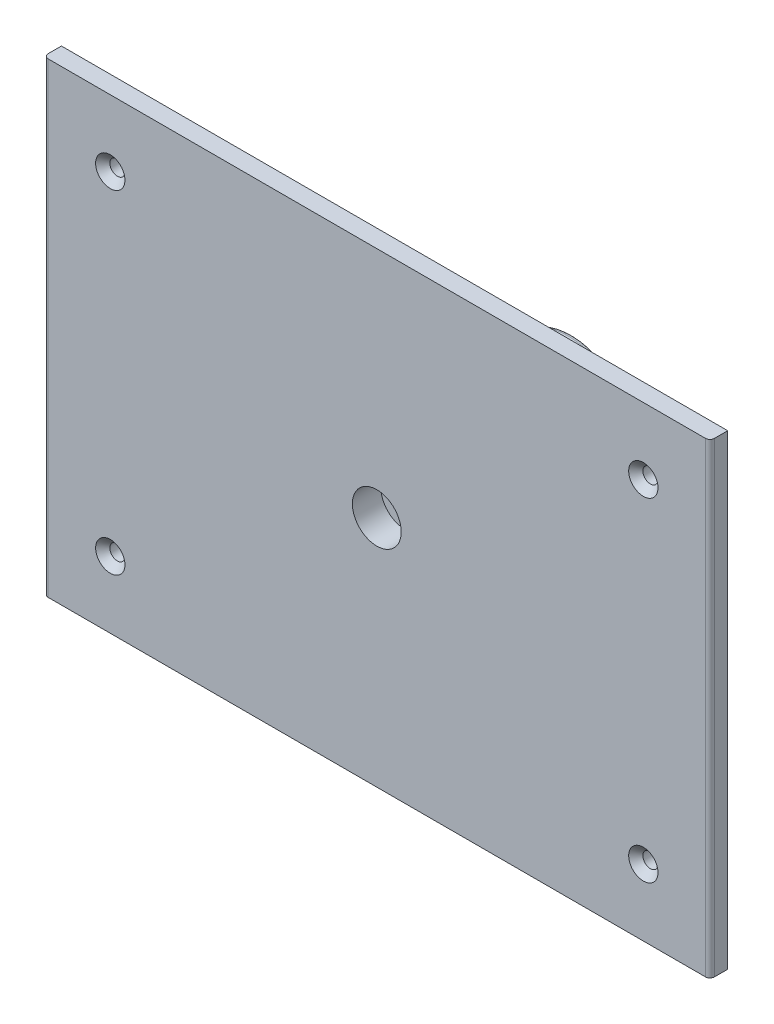
from build123d import *

# Parameters (mm, degrees)
SKETCH1_W                                           = 150
SKETCH1_H                                           = 105
BOSS_EXTRUDE1_DEPTH                                 = 2
M3_CLEARANCE_HOLE1_AT_2_COUNT                       = 2
M3_CLEARANCE_HOLE1_AT_2_PITCH                       = 120
SKETCH5_R                                           = 14
BOSS_EXTRUDE2_DEPTH                                 = 40
CBORE_FOR_M6_HEX_SOCKET_HEAD_CAP_SCREW1_D           = 6.6
CBORE_FOR_M6_HEX_SOCKET_HEAD_CAP_SCREW1_CBORE_D     = 11
CBORE_FOR_M6_HEX_SOCKET_HEAD_CAP_SCREW1_CBORE_DEPTH = 6.4
FILLET1_R                                           = 1
FILLET2_R                                           = 1
FILLET3_R                                           = 1


with BuildPart() as part:
    # Sketch1 → Boss-Extrude1 (new, symmetric)
    with BuildSketch(Plane.XY):
        Rectangle(SKETCH1_W, SKETCH1_H)
    extrude(amount=BOSS_EXTRUDE1_DEPTH, both=True)

    # Sketch4 → M3 Clearance Hole1 (revolve, cut)
    with BuildSketch(Plane(origin=(60, -37.5, -2), x_dir=(0, 1, 0), z_dir=(1, 0, 0))):
        Polygon((0, 0), (0, 4), (3.3, 4), (1.7, 2.4), (1.7, 0), align=None)
    m3_clearance_hole1 = revolve(axis=Axis((60, -37.5, -8.35), (0, 0, 1)), mode=Mode.SUBTRACT)

    # M3 Clearance Hole1 at 2: M3 Clearance Hole1 ×2
    with Locations(*[(-i * M3_CLEARANCE_HOLE1_AT_2_PITCH, 0, 0) for i in range(1, M3_CLEARANCE_HOLE1_AT_2_COUNT)]):
        add(m3_clearance_hole1, mode=Mode.SUBTRACT)

    # Sketch5 → Boss-Extrude2 (add)
    with BuildSketch(Plane(origin=(0, 0, -2), x_dir=(-1, 0, 0), z_dir=(0, 0, -1))):
        Circle(SKETCH5_R)
    extrude(amount=BOSS_EXTRUDE2_DEPTH)

    # CBORE for M6 Hex Socket Head Cap Screw1 (through all)
    with Locations(Plane.XY.offset(2)):
        with Locations((0, 0)):
            CounterBoreHole(CBORE_FOR_M6_HEX_SOCKET_HEAD_CAP_SCREW1_D / 2, CBORE_FOR_M6_HEX_SOCKET_HEAD_CAP_SCREW1_CBORE_D / 2, CBORE_FOR_M6_HEX_SOCKET_HEAD_CAP_SCREW1_CBORE_DEPTH)

    # Mirror1: M3 Clearance Hole1 across plane
    add(m3_clearance_hole1.mirror(Plane.ZX), mode=Mode.SUBTRACT)

    # Mirror1 copy 1 sketch → Mirror1 copy 1 (revolve, cut)
    with BuildSketch(Plane(origin=(-60, 37.5, -2), x_dir=(0, -1, 0), z_dir=(1, 0, 0))):
        Polygon((0, 0), (0, -4), (3.3, -4), (1.7, -2.4), (1.7, 0), align=None)
    revolve(axis=Axis((-60, 37.5, -8.35), (0, 0, -1)), mode=Mode.SUBTRACT)

    # Fillet1
    fillet1_edges = [part.edges().sort_by_distance(p)[0] for p in [
        (14, 0, -42),
    ]]
    fillet(fillet1_edges, radius=FILLET1_R)

    # Fillet2
    fillet2_edges = [part.edges().sort_by_distance(p)[0] for p in [
        (14, 0, -2),
    ]]
    fillet(fillet2_edges, radius=FILLET2_R)

    # Fillet3
    fillet3_edges = [part.edges().sort_by_distance(p)[0] for p in [
        (75, 0, 2),
        (-75, 0, 2),
    ]]
    fillet(fillet3_edges, radius=FILLET3_R)


solid = part.part
